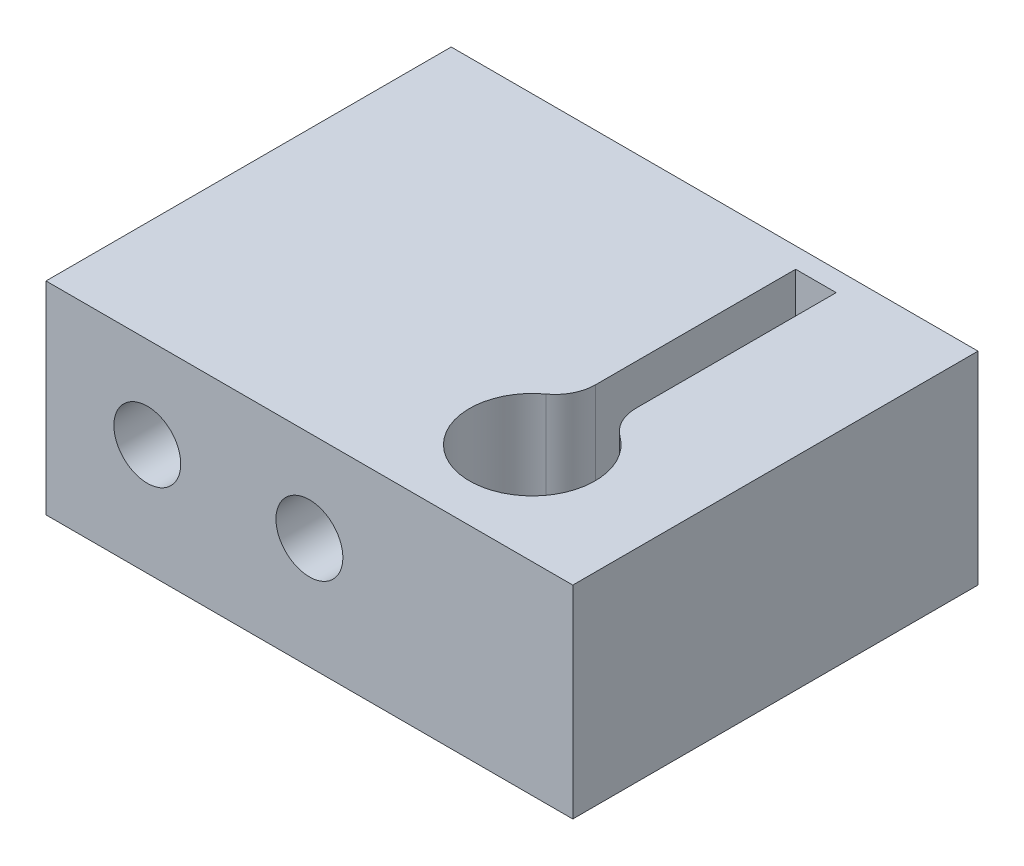
from build123d import *

# Parameters (mm, degrees)
SKETCH_1_W          = 26
SKETCH_1_H          = 20
EXTRUDE_1_DEPTH     = 25
CUT_EXTRUDE_1_DEPTH = 16
FILLET_1_R          = 2
SKETCH_3_R          = 1.25
CUT_EXTRUDE_2_DEPTH = 23.912878475
SKETCH_4_R          = 1.65
CUT_EXTRUDE_3_DEPTH = 35.554305086
SKETCH_5_W          = 20
SKETCH_5_H          = 5
CUT_EXTRUDE_4_DEPTH = 38.429934544
SKETCH_6_W          = 26
SKETCH_6_H          = 10
CUT_EXTRUDE_5_DEPTH = 35.554305086
SKETCH_7_W          = 2
SKETCH_7_H          = 1
EXTRUDE_2_DEPTH     = 10


with BuildPart() as part:
    # 草图1 → 凸台-拉伸1 (new body)
    with BuildSketch(Plane(origin=(0, 0, 0), x_dir=(1, 0, 0), z_dir=(0, 1, 0))):
        Rectangle(SKETCH_1_W, SKETCH_1_H)
    extrude(amount=EXTRUDE_1_DEPTH)

    # 草图2 → 切除-拉伸1 (cut)
    with BuildSketch(Plane.XZ):
        with BuildLine():
            Line((5, 2.06571985), (5, -10))
            Line((5, -10), (7, -10))
            Line((7, -10), (7, 2.06571985))
            ThreePointArc((7, 2.06571985), (6, 8.1), (5, 2.06571985))
        make_face()
    extrude(amount=-CUT_EXTRUDE_1_DEPTH, mode=Mode.SUBTRACT)

    # 圆角1
    fillet_1_edges = [part.edges().sort_by_distance(p)[0] for p in [
        (5, 8, 2.06571985),
        (7, 8, 2.06571985),
    ]]
    fillet(fillet_1_edges, radius=FILLET_1_R)

    # 草图3 → 切除-拉伸2 (cut, through all)
    with BuildSketch(Plane.XZ.offset(-16)):
        with Locations(Location((6, 5, 0), (0, 0, 270))):
            Circle(SKETCH_3_R)
    extrude(amount=-CUT_EXTRUDE_2_DEPTH, mode=Mode.SUBTRACT)

    # 草图4 → 切除-拉伸3 (cut, through all)
    with BuildSketch(Plane(origin=(0, 0, -10), x_dir=(-1, 0, 0), z_dir=(0, 0, -1))):
        with Locations((8, 10.5)):
            Circle(SKETCH_4_R)
        with Locations((0, 10.5)):
            Circle(SKETCH_4_R)
    extrude(amount=-CUT_EXTRUDE_3_DEPTH, mode=Mode.SUBTRACT)

    # 草图5 → 切除-拉伸4 (cut, through all)
    with BuildSketch(Plane(origin=(13, 0, 0), x_dir=(0, 0, -1), z_dir=(1, 0, 0))):
        with Locations((0, 2.5)):
            Rectangle(SKETCH_5_W, SKETCH_5_H)
    extrude(amount=-CUT_EXTRUDE_4_DEPTH, mode=Mode.SUBTRACT)

    # 草图6 → 切除-拉伸5 (cut, through all)
    with BuildSketch(Plane(origin=(0, 0, -10), x_dir=(-1, 0, 0), z_dir=(0, 0, -1))):
        with Locations((0, 20)):
            Rectangle(SKETCH_6_W, SKETCH_6_H)
    extrude(amount=-CUT_EXTRUDE_5_DEPTH, mode=Mode.SUBTRACT)

    # 草图7 → 凸台-拉伸2 (add)
    with BuildSketch(Plane(origin=(0, 15, 0), x_dir=(1, 0, 0), z_dir=(0, 1, 0))):
        with Locations((6, 9.5)):
            Rectangle(SKETCH_7_W, SKETCH_7_H)
    extrude(amount=-EXTRUDE_2_DEPTH)


solid = part.part
